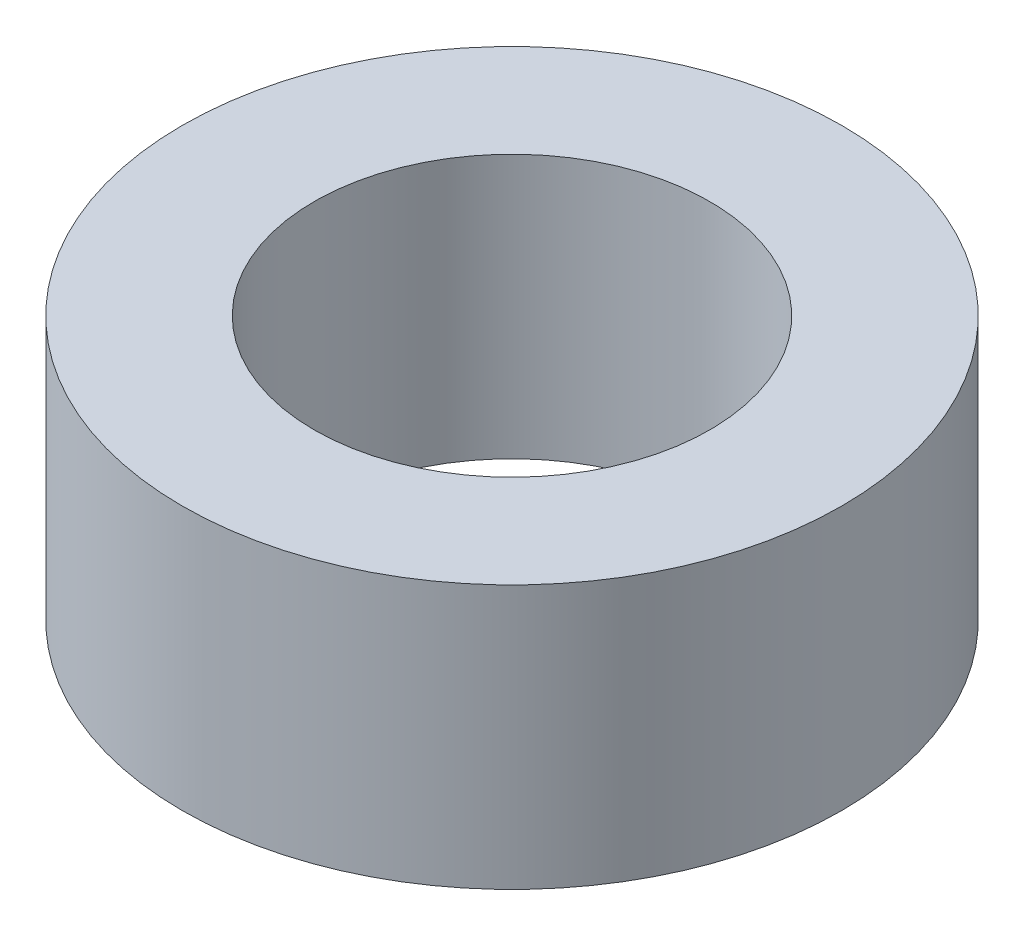
from build123d import *

# Parameters (mm, degrees)
SKETCH2_R           = 10
BOSS_EXTRUDE1_DEPTH = 8
SKETCH3_R           = 6
CUT_EXTRUDE1_DEPTH  = 17.248076809


with BuildPart() as part:
    # Sketch2 → Boss-Extrude1 (new body)
    with BuildSketch(Plane(origin=(0, 0, 0), x_dir=(1, 0, 0), z_dir=(0, 1, 0))):
        with Locations(Location((0, 0, 0), (0, 0, 270))):
            Circle(SKETCH2_R)
    extrude(amount=BOSS_EXTRUDE1_DEPTH)

    # Sketch3 → Cut-Extrude1 (cut, through all)
    with BuildSketch(Plane(origin=(0, 8, 0), x_dir=(1, 0, 0), z_dir=(0, 1, 0))):
        with Locations(Location((0, 0, 0), (0, 0, 270))):
            Circle(SKETCH3_R)
    extrude(amount=-CUT_EXTRUDE1_DEPTH, mode=Mode.SUBTRACT)


solid = part.part
